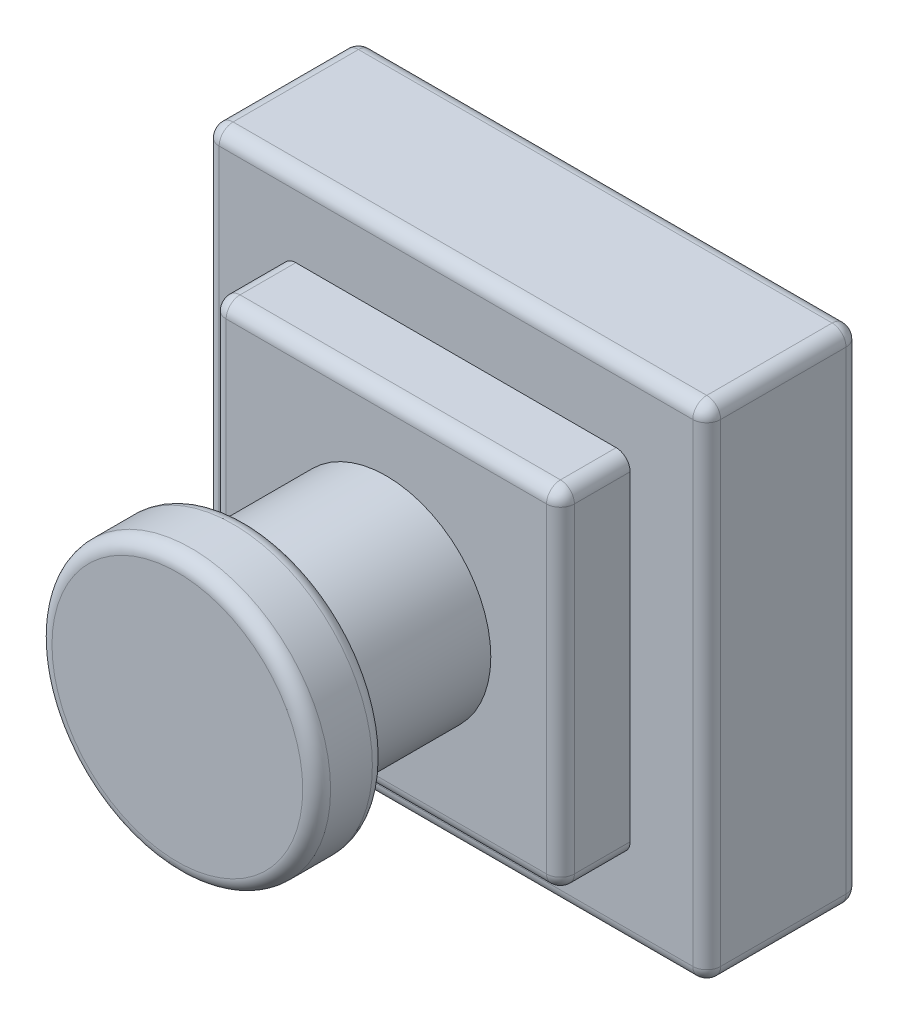
from build123d import *

# Parameters (mm, degrees)
SKETCH_1_W      = 36
SKETCH_1_H      = 36
EXTRUDE_1_DEPTH = 11
FILLET_1_R      = 1
SKETCH_2_W      = 25
SKETCH_2_H      = 25
EXTRUDE_2_DEPTH = 5
FILLET_2_R      = 1
SKETCH_3_R      = 7.5
EXTRUDE_3_DEPTH = 10
SKETCH_4_R      = 10
EXTRUDE_4_DEPTH = 5
FILLET_3_R      = 1


with BuildPart() as part:
    # 草图1 → 凸台-拉伸1 (new body)
    with BuildSketch(Plane.XY):
        with Locations((18, -18)):
            Rectangle(SKETCH_1_W, SKETCH_1_H)
    extrude(amount=EXTRUDE_1_DEPTH)

    # 圆角1
    fillet_1_edges = [part.edges().sort_by_distance(p)[0] for p in [
        (36, -18, 11),
        (18, 0, 11),
        (0, -18, 11),
        (18, 0, 0),
        (36, -18, 0),
        (18, -36, 0),
        (0, -18, 0),
        (0, 0, 5.5),
        (36, 0, 5.5),
        (36, -36, 5.5),
        (0, -36, 5.5),
        (18, -36, 11),
    ]]
    fillet(fillet_1_edges, radius=FILLET_1_R)

    # 草图2 → 凸台-拉伸2 (add)
    with BuildSketch(Plane.XY.offset(11)):
        with Locations((18, -18)):
            Rectangle(SKETCH_2_W, SKETCH_2_H)
    extrude(amount=EXTRUDE_2_DEPTH)

    # 圆角2
    fillet_2_edges = [part.edges().sort_by_distance(p)[0] for p in [
        (5.5, -5.5, 13.5),
        (5.5, -30.5, 13.5),
        (30.5, -30.5, 13.5),
        (30.5, -5.5, 13.5),
        (5.5, -18, 16),
        (18, -30.5, 16),
        (30.5, -18, 16),
        (18, -5.5, 16),
    ]]
    fillet(fillet_2_edges, radius=FILLET_2_R)

    # 草图3 → 凸台-拉伸3 (add)
    with BuildSketch(Plane.XY.offset(16)):
        with Locations((18, -18)):
            Circle(SKETCH_3_R)
    extrude(amount=EXTRUDE_3_DEPTH)

    # 草图4 → 凸台-拉伸4 (add)
    with BuildSketch(Plane.XY.offset(26)):
        with Locations((18, -18)):
            Circle(SKETCH_4_R)
    extrude(amount=EXTRUDE_4_DEPTH)

    # 圆角3
    fillet_3_edges = [part.edges().sort_by_distance(p)[0] for p in [
        (10.5, -18, 26),
        (8, -18, 26),
        (8, -18, 31),
    ]]
    fillet(fillet_3_edges, radius=FILLET_3_R)


solid = part.part
